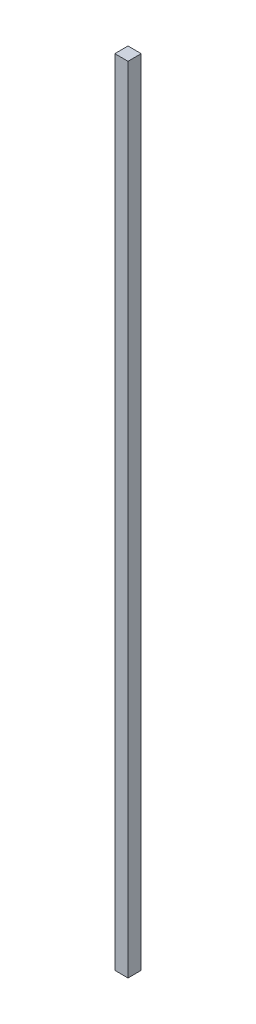
from build123d import *

# Parameters (mm, degrees)
SKETCH_1_W      = 50
SKETCH_1_H      = 50
EXTRUDE_1_DEPTH = 3000


with BuildPart() as part:
    # Эскиз1 → Бобышка-Вытянуть1 (new body)
    with BuildSketch(Plane(origin=(0, 0, 0), x_dir=(1, 0, 0), z_dir=(0, 1, 0))):
        Rectangle(SKETCH_1_W, SKETCH_1_H)
    extrude(amount=EXTRUDE_1_DEPTH)


solid = part.part
